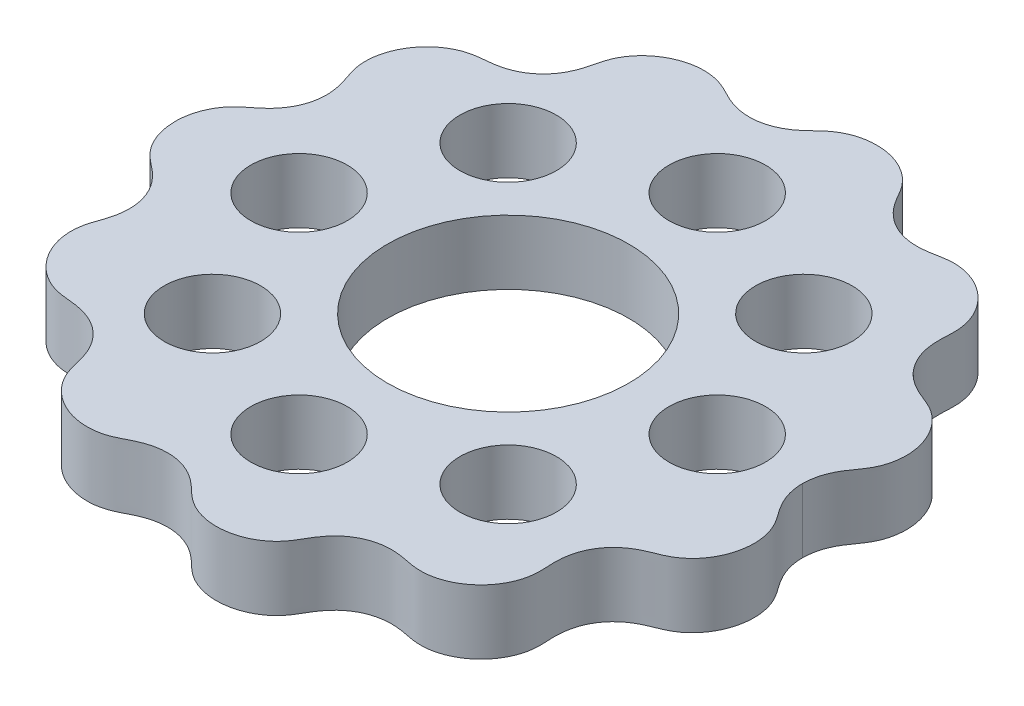
from build123d import *

# Parameters (mm, degrees)
SKETCH5_R           = 7.5
SKETCH5_R_2         = 3
BOSS_EXTRUDE1_DEPTH = 4


with BuildPart() as part:
    # Sketch5 → Boss-Extrude1 (new body)
    with BuildSketch(Plane(origin=(0, 0, 0), x_dir=(1, 0, 0), z_dir=(0, 1, 0))):
        with BuildLine():
            add(Edge.make_bspline(
                [(18.300001887, 0), (18.300010705, 0.215003642), (18.338753267, 0.679195711), (18.481842575, 1.210321363), (18.761018022, 1.769953886), (19.026922674, 2.177839709), (19.210941823, 2.435719572), (19.395680187, 2.692915456), (19.565636036, 2.960653153), (19.747906504, 3.312651466), (19.93864247, 3.834129911), (20.057403353, 4.540200664), (20.008357851, 5.405300521), (19.73988768, 6.299853158), (19.316404426, 7.035503992), (18.804461721, 7.597715814), (18.252322537, 8.001873087), (17.702817336, 8.258330995), (17.045959095, 8.495881339), (16.33809985, 8.864560366), (15.653899025, 9.450547644), (15.111166239, 10.288642285), (14.875683836, 11.0799767), (14.822703851, 11.725063966), (14.833067746, 12.274681518), (14.865342292, 12.727729927), (14.862671279, 13.260106684), (14.72837929, 13.933027823), (14.431180013, 14.635872275), (13.939794383, 15.329319559), (13.239260177, 15.947255395), (12.47536717, 16.35313672), (11.786732938, 16.540778236), (11.235218742, 16.586678139), (10.840465401, 16.56940856), (10.527116328, 16.527762316), (10.217294205, 16.467397556), (9.907369576, 16.40679263), (9.427779331, 16.332618687), (8.77060888, 16.305817429), (7.952186843, 16.4461635), (7.05753878, 16.886576705), (6.397338254, 17.492264381), (5.948604744, 18.14195596), (5.624727499, 18.753013498), (5.285770723, 19.249160517), (4.804691328, 19.725693077), (4.176014993, 20.140002558), (3.402438751, 20.439804509), (2.508657291, 20.56999395), (1.692711777, 20.503894327), (0.991598744, 20.296000008), (0.418872155, 19.998006776), (-0.02725181, 19.65754733), (-0.414581276, 19.267445025), (-0.814528019, 18.90348851), (-1.247986951, 18.593547535), (-1.711920278, 18.350461041), (-2.319399601, 18.138711547), (-3.078163454, 18.033252029), (-3.792383587, 18.109977363), (-4.419089964, 18.317056401), (-4.860951124, 18.522055264), (-5.142543266, 18.667497448), (-5.423490802, 18.813876291), (-5.712723674, 18.944234753), (-6.087139526, 19.074870645), (-6.630597424, 19.189860926), (-7.346667059, 19.20731203), (-8.196213037, 19.035978551), (-9.043604624, 18.643233497), (-9.711585586, 18.119766073), (-10.195342802, 17.53348167), (-10.517068924, 16.929963942), (-10.693108972, 16.349784917), (-10.834609167, 15.666278533), (-11.098084342, 14.912944072), (-11.580219609, 14.152147896), (-12.332698376, 13.493485596), (-13.154045362, 13.115864382), (-13.942503997, 12.956008438), (-14.645194298, 12.912269275), (-15.250766145, 12.822594904), (-15.897472911, 12.590223912), (-16.54739671, 12.195763284), (-17.160036154, 11.61172513), (-17.669121957, 10.834355582), (-17.961644901, 10.022765221), (-18.049722961, 9.314879519), (-18.017041175, 8.762586144), (-17.944075374, 8.374451054), (-17.858487142, 8.070258258), (-17.754769799, 7.772289566), (-17.650656333, 7.474276115), (-17.50880783, 7.010389693), (-17.388284102, 6.364073981), (-17.409918688, 5.53414754), (-17.717528668, 4.585603708), (-18.222482128, 3.845315705), (-18.801533842, 3.307998155), (-19.360494017, 2.900260179), (-19.803886321, 2.494354237), (-20.207639479, 1.950362105), (-20.529511005, 1.267444047), (-20.665736565, 0.676951062), (-20.699969648, 0.226217639), (-20.699980788, 0)],
                knots=[0.141360251, 0.141360251, 0.141360251, 0.141360251, 0.141360251, 0.147176466, 0.153918094, 0.156060029, 0.158201964, 0.160343899, 0.162485834, 0.164627769, 0.166769704, 0.171053574, 0.177448288, 0.183843002, 0.189974304, 0.196105605, 0.200190466, 0.204275326, 0.208360186, 0.212445047, 0.219092122, 0.225739198, 0.232410023, 0.239080848, 0.241129578, 0.243178308, 0.247275769, 0.251373229, 0.255470689, 0.26162196, 0.267773231, 0.274147854, 0.280522477, 0.284792468, 0.286927463, 0.289062458, 0.291197453, 0.293332448, 0.295467443, 0.297602438, 0.304323247, 0.311044057, 0.317624667, 0.324205277, 0.32825003, 0.332294783, 0.336339536, 0.34038429, 0.34645539, 0.35252649, 0.358575019, 0.364623549, 0.368400769, 0.372177989, 0.375955209, 0.379732429, 0.383262932, 0.386793435, 0.390323938, 0.393854441, 0.400598657, 0.407342873, 0.409485678, 0.411628483, 0.413771288, 0.415914094, 0.418056899, 0.420199704, 0.424485315, 0.430882535, 0.437279755, 0.443408557, 0.44953736, 0.453620655, 0.457703951, 0.461787247, 0.465870543, 0.472514633, 0.479158722, 0.485845752, 0.492532781, 0.496656173, 0.500779565, 0.504902957, 0.509026349, 0.515118169, 0.521209989, 0.527582095, 0.533954202, 0.538222463, 0.540356594, 0.542490724, 0.544624855, 0.546758986, 0.548893116, 0.551027247, 0.557745439, 0.564463631, 0.571046705, 0.577629779, 0.581676342, 0.585722905, 0.589769469, 0.593816032, 0.59988964, 0.606009754, 0.606009754, 0.606009754, 0.606009754, 0.606009754], degree=4))
            add(Edge.make_bspline(
                [(18.300001887, 0), (18.300010705, -0.215003642), (18.338753267, -0.679195711), (18.481842575, -1.210321363), (18.761018022, -1.769953886), (19.026922674, -2.177839709), (19.210941823, -2.435719572), (19.395680187, -2.692915456), (19.565636036, -2.960653153), (19.747906504, -3.312651466), (19.93864247, -3.834129911), (20.057403353, -4.540200664), (20.008357851, -5.405300521), (19.73988768, -6.299853158), (19.316404426, -7.035503991), (18.804461721, -7.597715814), (18.252322537, -8.001873087), (17.702817336, -8.258330995), (17.045959095, -8.495881339), (16.33809985, -8.864560366), (15.653899025, -9.450547644), (15.111166239, -10.288642285), (14.875683836, -11.0799767), (14.822703851, -11.725063966), (14.833067746, -12.274681518), (14.865342292, -12.727729927), (14.862671279, -13.260106684), (14.72837929, -13.933027823), (14.431180013, -14.635872275), (13.939794383, -15.329319559), (13.239260177, -15.947255395), (12.47536717, -16.35313672), (11.786732938, -16.540778236), (11.235218742, -16.586678139), (10.840465401, -16.56940856), (10.527116328, -16.527762316), (10.217294205, -16.467397556), (9.907369576, -16.40679263), (9.427779331, -16.332618687), (8.77060888, -16.305817429), (7.952186843, -16.4461635), (7.05753878, -16.886576705), (6.397338254, -17.492264381), (5.948604744, -18.14195596), (5.624727499, -18.753013498), (5.285770723, -19.249160517), (4.804691328, -19.725693077), (4.176014993, -20.140002558), (3.402438751, -20.439804509), (2.508657291, -20.56999395), (1.692711777, -20.503894327), (0.991598744, -20.296000008), (0.418872155, -19.998006776), (-0.02725181, -19.65754733), (-0.414581276, -19.267445025), (-0.814528019, -18.90348851), (-1.247986951, -18.593547535), (-1.711920278, -18.350461041), (-2.319399601, -18.138711547), (-3.078163454, -18.033252029), (-3.792383587, -18.109977363), (-4.419089964, -18.317056401), (-4.860951124, -18.522055264), (-5.142543266, -18.667497448), (-5.423490802, -18.813876291), (-5.712723674, -18.944234753), (-6.087139526, -19.074870645), (-6.630597424, -19.189860926), (-7.346667059, -19.20731203), (-8.196213037, -19.035978551), (-9.043604624, -18.643233497), (-9.711585586, -18.119766073), (-10.195342802, -17.53348167), (-10.517068924, -16.929963942), (-10.693108972, -16.349784917), (-10.834609167, -15.666278533), (-11.098084342, -14.912944072), (-11.580219609, -14.152147896), (-12.332698376, -13.493485596), (-13.154045362, -13.115864382), (-13.942503997, -12.956008438), (-14.645194298, -12.912269275), (-15.250766145, -12.822594904), (-15.897472911, -12.590223912), (-16.54739671, -12.195763284), (-17.160036154, -11.61172513), (-17.669121957, -10.834355582), (-17.961644901, -10.022765221), (-18.049722961, -9.314879519), (-18.017041175, -8.762586144), (-17.944075374, -8.374451054), (-17.858487142, -8.070258258), (-17.754769799, -7.772289566), (-17.650656333, -7.474276115), (-17.50880783, -7.010389693), (-17.388284102, -6.364073981), (-17.409918688, -5.53414754), (-17.717528668, -4.585603708), (-18.222482128, -3.845315705), (-18.801533842, -3.307998155), (-19.360494017, -2.900260179), (-19.803886321, -2.494354237), (-20.207639479, -1.950362105), (-20.529511005, -1.267444047), (-20.665736565, -0.676951062), (-20.699969648, -0.226217639), (-20.699980788, 0)],
                knots=[0.141360251, 0.141360251, 0.141360251, 0.141360251, 0.141360251, 0.147176466, 0.153918094, 0.156060029, 0.158201964, 0.160343899, 0.162485834, 0.164627769, 0.166769704, 0.171053574, 0.177448288, 0.183843002, 0.189974304, 0.196105605, 0.200190466, 0.204275326, 0.208360186, 0.212445047, 0.219092122, 0.225739198, 0.232410023, 0.239080848, 0.241129578, 0.243178308, 0.247275769, 0.251373229, 0.255470689, 0.26162196, 0.267773231, 0.274147854, 0.280522477, 0.284792468, 0.286927463, 0.289062458, 0.291197453, 0.293332448, 0.295467443, 0.297602438, 0.304323247, 0.311044057, 0.317624667, 0.324205277, 0.32825003, 0.332294783, 0.336339536, 0.34038429, 0.34645539, 0.35252649, 0.358575019, 0.364623549, 0.368400769, 0.372177989, 0.375955209, 0.379732429, 0.383262932, 0.386793435, 0.390323938, 0.393854441, 0.400598657, 0.407342873, 0.409485678, 0.411628483, 0.413771288, 0.415914094, 0.418056899, 0.420199704, 0.424485315, 0.430882535, 0.437279755, 0.443408557, 0.44953736, 0.453620655, 0.457703951, 0.461787247, 0.465870543, 0.472514633, 0.479158722, 0.485845752, 0.492532781, 0.496656173, 0.500779565, 0.504902957, 0.509026349, 0.515118169, 0.521209989, 0.527582095, 0.533954202, 0.538222463, 0.540356594, 0.542490724, 0.544624855, 0.546758986, 0.548893116, 0.551027247, 0.557745439, 0.564463631, 0.571046705, 0.577629779, 0.581676342, 0.585722905, 0.589769469, 0.593816032, 0.59988964, 0.606009754, 0.606009754, 0.606009754, 0.606009754, 0.606009754], degree=4))
        make_face()
        with Locations(Location((0, 0, 0), (0, 0, 270))):
            Circle(SKETCH5_R, mode=Mode.SUBTRACT)
        with Locations(Location((-9.192388155, -9.192388155, 0), (0, 0, 270))):
            Circle(SKETCH5_R_2, mode=Mode.SUBTRACT)
        with Locations(Location((0, -13, 0), (0, 0, 270))):
            Circle(SKETCH5_R_2, mode=Mode.SUBTRACT)
        with Locations(Location((9.192388155, -9.192388155, 0), (0, 0, 270))):
            Circle(SKETCH5_R_2, mode=Mode.SUBTRACT)
        with Locations(Location((13, 0, 0), (0, 0, 270))):
            Circle(SKETCH5_R_2, mode=Mode.SUBTRACT)
        with Locations(Location((9.192388155, 9.192388155, 0), (0, 0, 270))):
            Circle(SKETCH5_R_2, mode=Mode.SUBTRACT)
        with Locations(Location((0, 13, 0), (0, 0, 270))):
            Circle(SKETCH5_R_2, mode=Mode.SUBTRACT)
        with Locations(Location((-9.192388155, 9.192388155, 0), (0, 0, 270))):
            Circle(SKETCH5_R_2, mode=Mode.SUBTRACT)
        with Locations(Location((-13, 0, 0), (0, 0, 270))):
            Circle(SKETCH5_R_2, mode=Mode.SUBTRACT)
    extrude(amount=BOSS_EXTRUDE1_DEPTH)


solid = part.part
